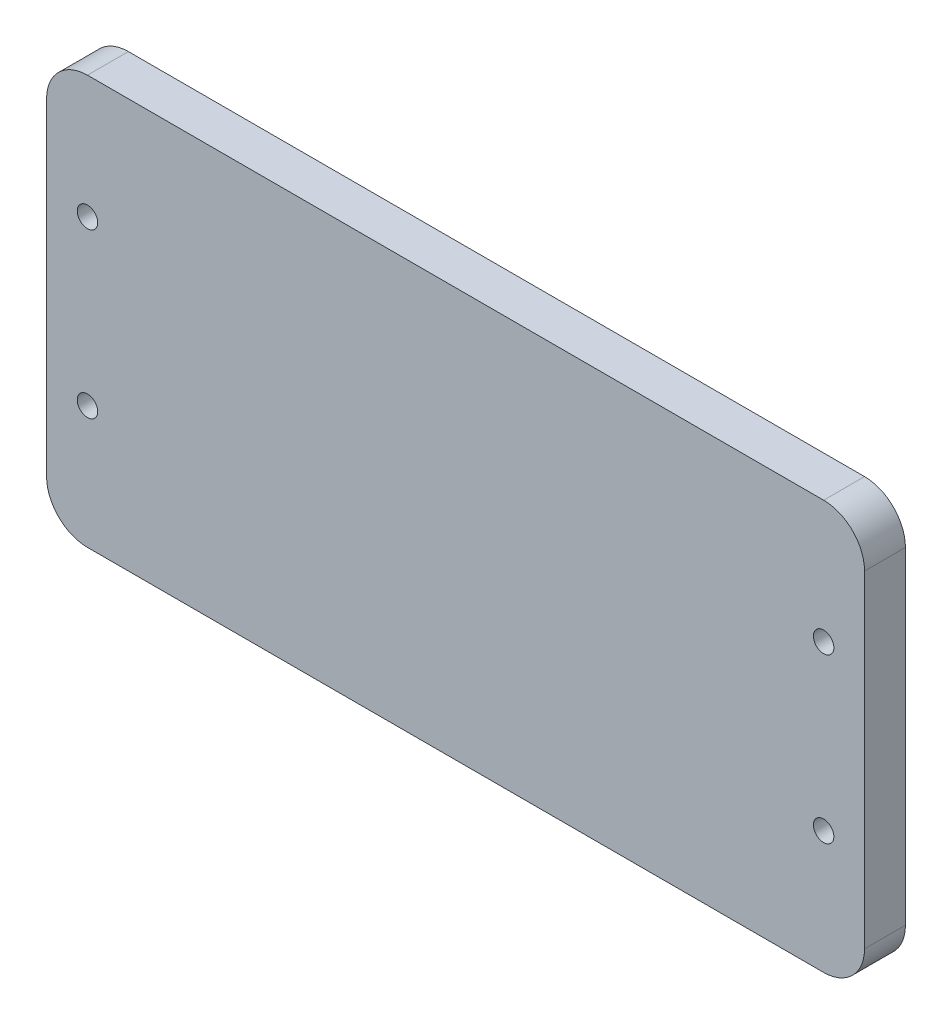
from build123d import *

# Parameters (mm, degrees)
SKETCH1_W           = 200
SKETCH1_H           = 100
SKETCH1_R           = 2.5
BOSS_EXTRUDE1_DEPTH = 10
FILLET1_R           = 10


with BuildPart() as part:
    # Sketch1 → Boss-Extrude1 (new body)
    with BuildSketch(Plane.XY):
        Rectangle(SKETCH1_W, SKETCH1_H)
        with Locations((90, 20)):
            Circle(SKETCH1_R, mode=Mode.SUBTRACT)
        with Locations(Location((-90, 20, 0), (0, 0, 180))):
            Circle(SKETCH1_R, mode=Mode.SUBTRACT)
        with Locations(Location((90, -20, 0), (0, 0, 180))):
            Circle(SKETCH1_R, mode=Mode.SUBTRACT)
        with Locations((-90, -20)):
            Circle(SKETCH1_R, mode=Mode.SUBTRACT)
    extrude(amount=BOSS_EXTRUDE1_DEPTH)

    # Fillet1
    fillet1_edges = [part.edges().sort_by_distance(p)[0] for p in [
        (100, -50, 5),
        (-100, -50, 5),
        (-100, 50, 5),
        (100, 50, 5),
    ]]
    fillet(fillet1_edges, radius=FILLET1_R)


solid = part.part
